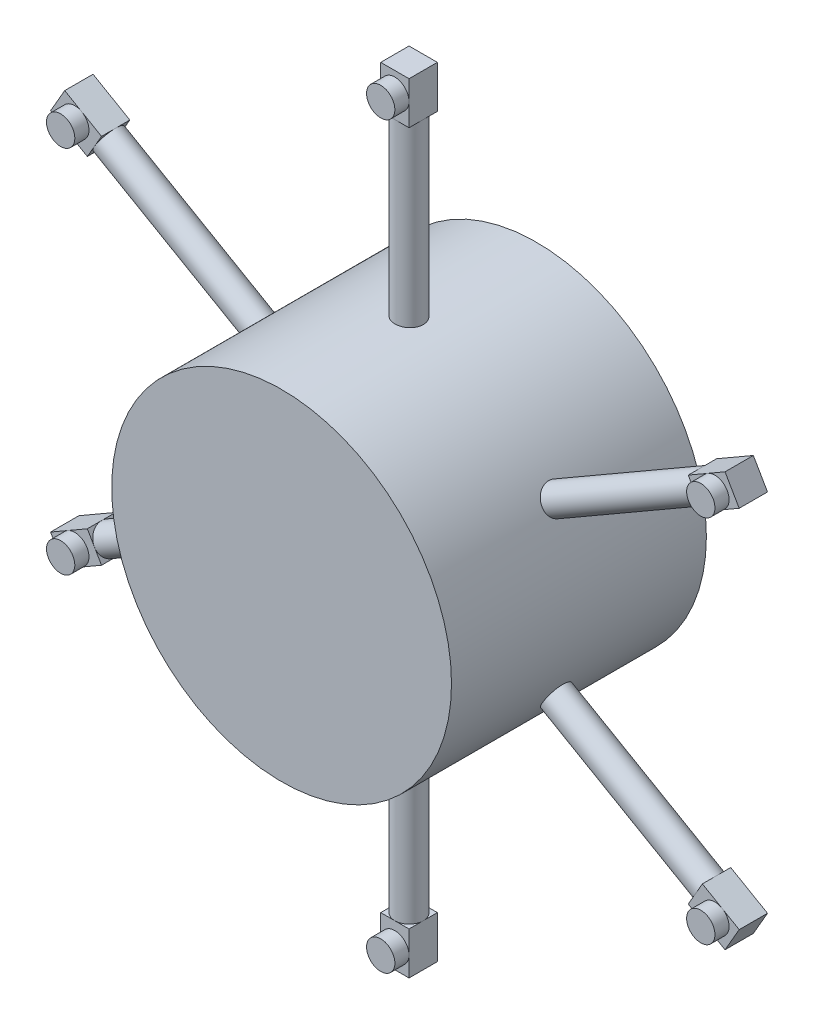
from build123d import *

# Parameters (mm, degrees)
SKETCH_6_R               = 5
SKETCH_8_W               = 10
SKETCH_8_H               = 10
EXTRUDE_1_DEPTH          = 7.5
SKETCH_9_R               = 5
EXTRUDE_2_DEPTH          = 5
SKETCH_11_R              = 60
EXTRUDE_3_DEPTH          = 45
PATTERN_CIRCULAR_1_COUNT = 6


with BuildPart() as part:
    # 掃出1: sweep along a path in 草圖7
    with BuildLine(Plane.XY) as sweep_1_path:
        Line((0, 0), (0, 130))
    # 草圖6 → 掃出1 (sweep)
    with BuildSketch(Plane(origin=(0, 0, 0), x_dir=(1, 0, 0), z_dir=(0, 1, 0))):
        Circle(SKETCH_6_R)
    sweep_1 = sweep(path=sweep_1_path.line)

    # 草圖8 → 填料-伸長1 (add, symmetric)
    with BuildSketch(Plane.XZ):
        Rectangle(SKETCH_8_W, SKETCH_8_H)
    extrude_1 = extrude(amount=EXTRUDE_1_DEPTH, both=True)

    # 草圖9 → 填料-伸長2 (add, symmetric)
    with BuildSketch(Plane.XY.offset(5)):
        with Locations((0, -0.5)):
            Circle(SKETCH_9_R)
    extrude_2 = extrude(amount=EXTRUDE_2_DEPTH, both=True)

    # 草圖11 → 填料-伸長3 (add, symmetric)
    with BuildSketch(Plane.XY):
        with Locations((0, 130)):
            Circle(SKETCH_11_R)
    extrude(amount=EXTRUDE_3_DEPTH, both=True)

    # 環狀複製排列1: 掃出1, 填料-伸長1, 填料-伸長2 ×6 about axis
    pattern_circular_1_axis = Axis((0, 130, 0), (0, 0, 1))
    add([sweep_1.rotate(pattern_circular_1_axis, i * 360 / PATTERN_CIRCULAR_1_COUNT) for i in range(1, PATTERN_CIRCULAR_1_COUNT)])
    add([extrude_1.rotate(pattern_circular_1_axis, i * 360 / PATTERN_CIRCULAR_1_COUNT) for i in range(1, PATTERN_CIRCULAR_1_COUNT)])
    add([extrude_2.rotate(pattern_circular_1_axis, i * 360 / PATTERN_CIRCULAR_1_COUNT) for i in range(1, PATTERN_CIRCULAR_1_COUNT)])


solid = part.part
